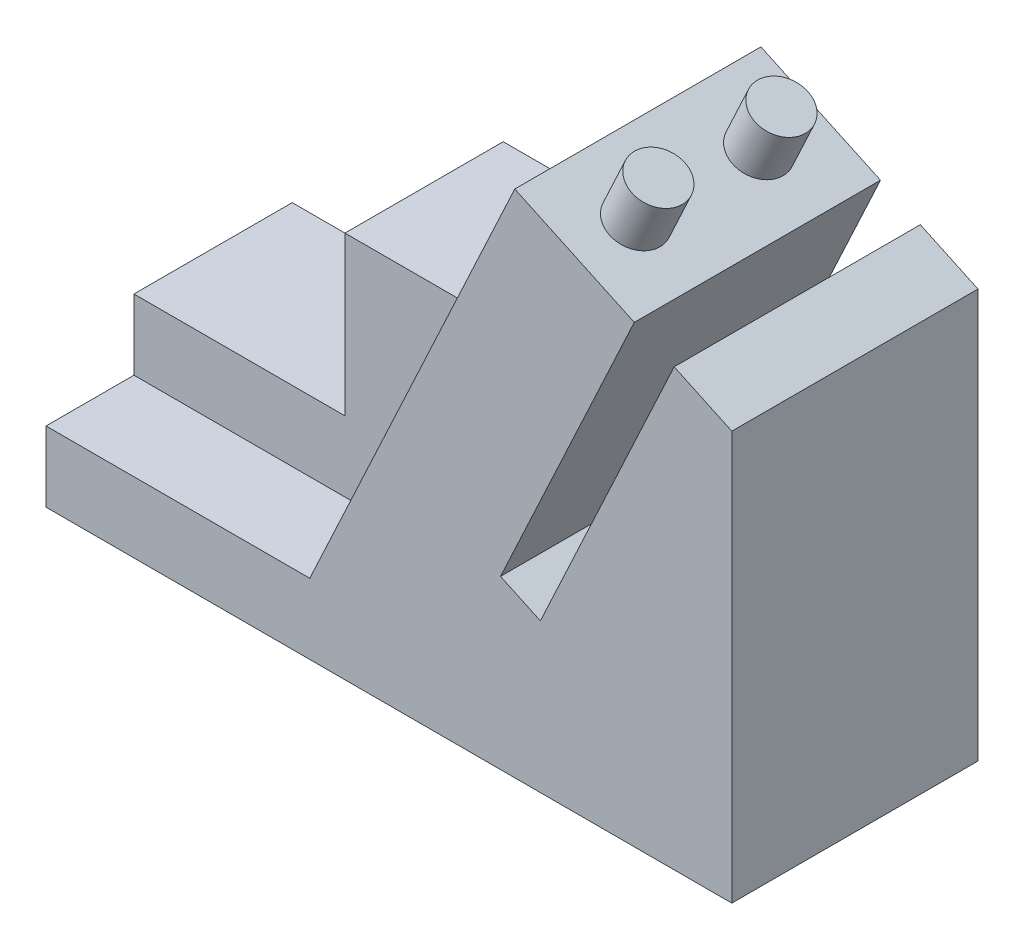
from build123d import *

# Parameters (mm, degrees)
DODANIE_WYCI_GNI_CIE1_DEPTH = 28
SZKIC2_R                    = 3
DODANIE_WYCI_GNI_CIE2_DEPTH = 6
DODANIE_WYCI_GNI_CIE3_DEPTH = 18


with BuildPart() as part:
    # Szkic1 → Dodanie-wyciągnięcie1 (new body)
    with BuildSketch(Plane.XY):
        Polygon((0, 0), (78, 0), (78, 46.489374011), (71.441538648, 49.547634765), (56.227281226, 16.920554432), (51.695742291, 19.033645741), (66.909999713, 51.660726074), (53.315382908, 58), (30, 8), (0, 8), align=None)
    extrude(amount=DODANIE_WYCI_GNI_CIE1_DEPTH)

    # Szkic2 → Dodanie-wyciągnięcie2 (add)
    with BuildSketch(Plane(origin=(31.737746535, 68.061817086, 0), x_dir=(0.9063077870366479, -0.4226182617407039, 0), z_dir=(0.4226182617407039, 0.906307787036648, 0))):
        with Locations((31.308287517, -7)):
            Circle(SZKIC2_R)
        with Locations((31.308287517, -21)):
            Circle(SZKIC2_R)
    extrude(amount=DODANIE_WYCI_GNI_CIE2_DEPTH)

    # Szkic3 → Dodanie-wyciągnięcie3 (add)
    with BuildSketch(Plane.XY):
        Polygon((0, 8), (0, 16), (24, 16), (24, 34), (42.123999112, 34), (30, 8), align=None)
    extrude(amount=DODANIE_WYCI_GNI_CIE3_DEPTH)


solid = part.part
